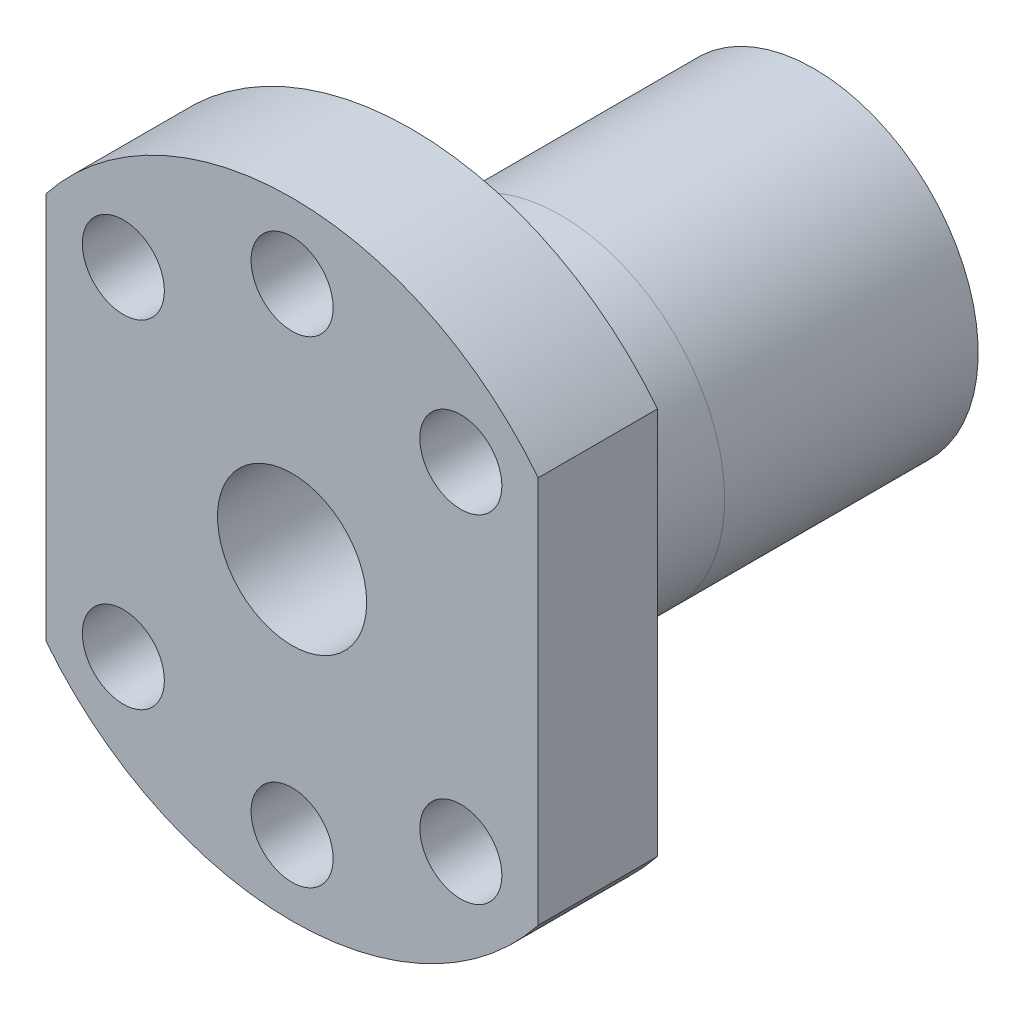
from build123d import *

# Parameters (mm, degrees)
CUT_EXTRUDE_START        = -4
CUT_EXTRUDE_7_DEPTH      = 8
SKETCH_5_R               = 2.75
CUT_EXTRUDE_2_DEPTH      = 8
SKETCH_6_R               = 2.75
CUT_EXTRUDE_3_DEPTH      = 8
CUT_EXTRUDE_5_DEPTH      = 41.917600125
CUT_EXTRUDE_5_DEPTH_BACK = 41.917600125
SKETCH_8_R               = 5
EXTRUDE_START            = -75
SKETCH_10_R              = 5
EXTRUDE_1_DEPTH          = 150


with BuildPart() as part:
    # 草图3 → 旋转1 (revolve)
    with BuildSketch(Plane(origin=(0, 0, 0), x_dir=(0, 0, -1), z_dir=(1, 0, 0)), mode=Mode.PRIVATE) as revolve_1_sk:
        Polygon((-4, 0), (-4, 21), (4, 21), (4, 11), (31, 11), (31, 0), align=None)
    revolve(revolve_1_sk.sketch.rotate(Axis((0, 0, 4), (0, 0, -1)), 180), axis=Axis((0, 0, 4), (0, 0, -1)))

    # 草图13 → 切除-拉伸7 (cut)
    with BuildSketch(Plane.XY.offset(CUT_EXTRUDE_START)):
        with BuildLine():
            Line((-16.5, -12.990381057), (-16.5, 12.990381057))
            ThreePointArc((-16.5, 12.990381057), (-21, 0), (-16.5, -12.990381057))
        make_face()
        with BuildLine():
            Line((16.5, 12.990381057), (16.5, -12.990381057))
            ThreePointArc((16.5, -12.990381057), (21, 0), (16.5, 12.990381057))
        make_face()
    extrude(amount=CUT_EXTRUDE_7_DEPTH, mode=Mode.SUBTRACT)

    # 草图5 → 切除-拉伸2 (cut)
    with BuildSketch(Plane.XY.offset(CUT_EXTRUDE_START)):
        with Locations((-11.313708499, 11.313708499)):
            Circle(SKETCH_5_R)
        with Locations((11.313708499, 11.313708499)):
            Circle(SKETCH_5_R)
    cut_extrude_2 = extrude(amount=CUT_EXTRUDE_2_DEPTH, mode=Mode.SUBTRACT)

    # 镜向1: 切除-拉伸2 across plane
    add(cut_extrude_2.mirror(Plane.ZX), mode=Mode.SUBTRACT)

    # 草图6 → 切除-拉伸3 (cut)
    with BuildSketch(Plane.XY.offset(CUT_EXTRUDE_START)):
        with Locations((0, 16)):
            Circle(SKETCH_6_R)
    cut_extrude_3 = extrude(amount=CUT_EXTRUDE_3_DEPTH, mode=Mode.SUBTRACT)

    # 镜向2: 切除-拉伸3 across plane
    add(cut_extrude_3.mirror(Plane.ZX), mode=Mode.SUBTRACT)

    # 草图8 → 切除-拉伸5 (cut, two sides: drawn at the far end of the back side and taken through both)
    with BuildSketch(Plane.XY.offset(-CUT_EXTRUDE_5_DEPTH_BACK)):
        Circle(SKETCH_8_R)
    extrude(amount=CUT_EXTRUDE_5_DEPTH + CUT_EXTRUDE_5_DEPTH_BACK, mode=Mode.SUBTRACT)


with BuildPart() as body_2:
    # 草图10 → 凸台-拉伸1 (new body)
    with BuildSketch(Plane.XY.offset(EXTRUDE_START)):
        Circle(SKETCH_10_R)
    extrude(amount=EXTRUDE_1_DEPTH)


solid = part.part
